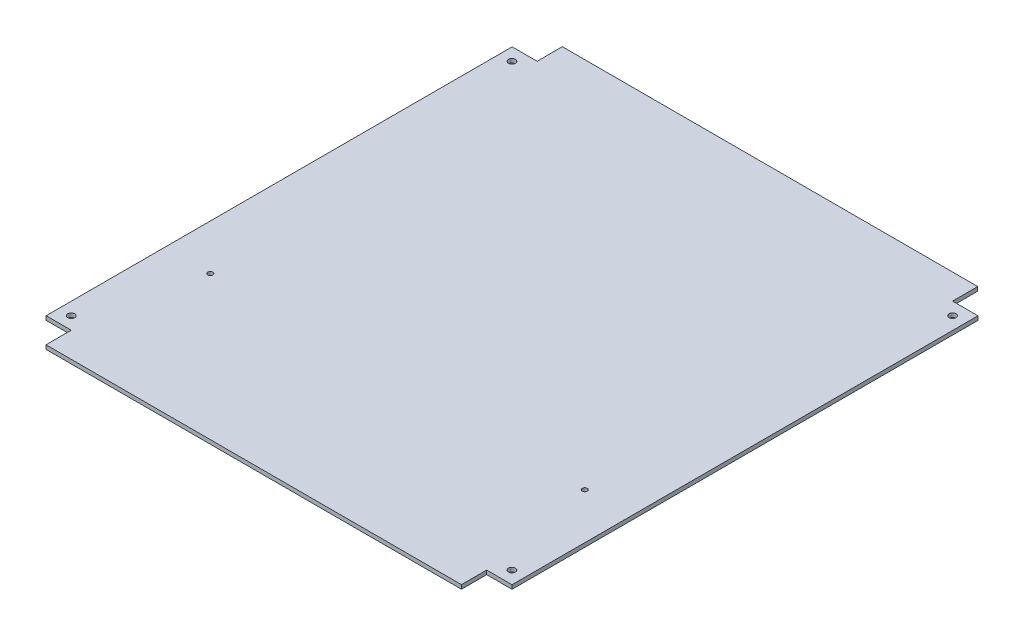
from build123d import *

# Parameters (mm, degrees)
BOSS_EXTRUDE1_DEPTH = 3.175
SKETCH2_R           = 2.75
CUT_EXTRUDE1_DEPTH  = 3.175
SKETCH3_R           = 2
CUT_EXTRUDE2_DEPTH  = 3.175


with BuildPart() as part:
    # Sketch1 → Boss-Extrude1 (new body)
    with BuildSketch(Plane(origin=(0, 0, 0), x_dir=(1, 0, 0), z_dir=(0, 1, 0))):
        Polygon((-164.75564006, -204.974359939), (-164.75564006, -184.974359939), (-184.65564006, -184.974359939), (-184.55564006, 184.61064006), (-164.65564006, 184.61064006), (-164.75564006, 204.61064006), (164.81935994, 204.61064006), (164.81935994, 184.61064006), (185.01935994, 184.61064006), (184.92935994, -184.974359939), (164.81935994, -184.974359939), (164.81935994, -204.974359939), (-163.362720717, -204.974359939), align=None)
    extrude(amount=BOSS_EXTRUDE1_DEPTH)

    # Sketch2 → Cut-Extrude1 (cut)
    with BuildSketch(Plane(origin=(0, 3.175, 0), x_dir=(1, 0, 0), z_dir=(0, 1, 0))):
        with Locations(Location((-174.70564006, -174.974360305, 0), (0, 0, 270))):
            Circle(SKETCH2_R)
        with Locations(Location((174.86935994, -174.974360305, 0), (0, 0, 270))):
            Circle(SKETCH2_R)
        with Locations(Location((174.86935994, 174.600639695, 0), (0, 0, 270))):
            Circle(SKETCH2_R)
        with Locations(Location((-174.70564006, 174.600639695, 0), (0, 0, 270))):
            Circle(SKETCH2_R)
    extrude(amount=-CUT_EXTRUDE1_DEPTH, mode=Mode.SUBTRACT)

    # Sketch3 → Cut-Extrude2 (cut)
    with BuildSketch(Plane(origin=(0, 3.175, 0), x_dir=(1, 0, 0), z_dir=(0, 1, 0))):
        with Locations(Location((-148.50314006, -90.898359939, 0), (0, 0, 270))):
            Circle(SKETCH3_R)
        with Locations(Location((148.55685994, -90.898359939, 0), (0, 0, 270))):
            Circle(SKETCH3_R)
    extrude(amount=-CUT_EXTRUDE2_DEPTH, mode=Mode.SUBTRACT)


solid = part.part
